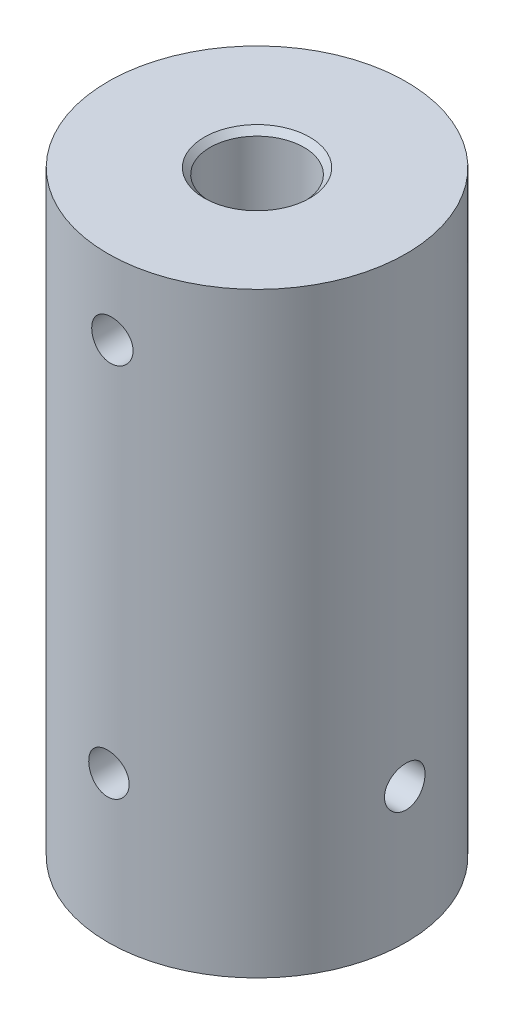
from build123d import *

# Parameters (mm, degrees)
SKETCH1_R                             = 12.7
BOSS_EXTRUDE1_DEPTH                   = 50.8
F_8_0_8_DIAMETER_HOLE1_D              = 8
F_8_0_8_DIAMETER_HOLE1_DEPTH          = 16.51
F_8_0_8_DIAMETER_HOLE1_CSINK_D        = 9
F_8_0_8_DIAMETER_HOLE1_CSINK_ANGLE    = 90
F_8_0_8_DIAMETER_HOLE1_TIP            = 2.403442476
F_8_32_TAPPED_HOLE1_REACH             = 54.894
F_8_32_TAPPED_HOLE1_BORE_R            = 1.7272
F_3_4_0_75_DIAMETER_HOLE1_D           = 19.05
F_3_4_0_75_DIAMETER_HOLE1_DEPTH       = 22.86
F_3_4_0_75_DIAMETER_HOLE1_CSINK_D     = 20.32
F_3_4_0_75_DIAMETER_HOLE1_CSINK_ANGLE = 90
F_3_4_0_75_DIAMETER_HOLE1_TIP         = 5.723197396
TAP_DRILL_FOR_8_32_TAP1_REACH         = 49.733
TAP_DRILL_FOR_8_32_TAP1_BORE_R        = 1.7272
TAP_DRILL_FOR_8_32_TAP2_REACH         = 50.487
TAP_DRILL_FOR_8_32_TAP2_BORE_R        = 1.7272


with BuildPart() as part:
    # Sketch1 → Boss-Extrude1 (new body)
    with BuildSketch(Plane(origin=(0, 0, 0), x_dir=(1, 0, 0), z_dir=(0, 1, 0))):
        with Locations(Location((0, 0, 0), (0, 0, 270))):
            Circle(SKETCH1_R)
    extrude(amount=BOSS_EXTRUDE1_DEPTH)

    # Ø8.0 (8) Diameter Hole1
    with Locations(Plane(origin=(0, 50.8, 0), x_dir=(1, 0, 0), z_dir=(0, 1, 0))):
        with Locations((0, 0)):
            CounterSinkHole(F_8_0_8_DIAMETER_HOLE1_D / 2, F_8_0_8_DIAMETER_HOLE1_CSINK_D / 2, depth=F_8_0_8_DIAMETER_HOLE1_DEPTH, counter_sink_angle=F_8_0_8_DIAMETER_HOLE1_CSINK_ANGLE)
            with Locations((0, 0, -(F_8_0_8_DIAMETER_HOLE1_DEPTH + F_8_0_8_DIAMETER_HOLE1_TIP / 2))):  # 118° drill point
                Cone(0, F_8_0_8_DIAMETER_HOLE1_D / 2, F_8_0_8_DIAMETER_HOLE1_TIP, mode=Mode.SUBTRACT)

    # #8-32 Tapped Hole1 bore (on position points) → #8-32 Tapped Hole1 (cut, up to next)
    with BuildSketch(Plane(origin=(0.258881907, 44.551690017, 12.697361149), x_dir=(0.999792216488, 0, -0.020384402145), z_dir=(0.020384402145, 0, 0.999792216488)), mode=Mode.PRIVATE) as f_8_32_tapped_hole1_sk1:
        Circle(F_8_32_TAPPED_HOLE1_BORE_R)
    f_8_32_tapped_hole1_tool1 = extrude(f_8_32_tapped_hole1_sk1.sketch, amount=-F_8_32_TAPPED_HOLE1_REACH, mode=Mode.PRIVATE) & part.part
    add(f_8_32_tapped_hole1_tool1.solids().sort_by_distance((0.258882, 44.55169, 12.697361))[0], mode=Mode.SUBTRACT)

    # 3/4 (0.75) Diameter Hole1
    with Locations(Plane(origin=(0, 0, 0), x_dir=(-1, 0, 0), z_dir=(0, -1, 0))):
        with Locations((0, 0)):
            CounterSinkHole(F_3_4_0_75_DIAMETER_HOLE1_D / 2, F_3_4_0_75_DIAMETER_HOLE1_CSINK_D / 2, depth=F_3_4_0_75_DIAMETER_HOLE1_DEPTH, counter_sink_angle=F_3_4_0_75_DIAMETER_HOLE1_CSINK_ANGLE)
            with Locations((0, 0, -(F_3_4_0_75_DIAMETER_HOLE1_DEPTH + F_3_4_0_75_DIAMETER_HOLE1_TIP / 2))):  # 118° drill point
                Cone(0, F_3_4_0_75_DIAMETER_HOLE1_D / 2, F_3_4_0_75_DIAMETER_HOLE1_TIP, mode=Mode.SUBTRACT)

    # Tap Drill for #8-32 Tap1 bore (on position points) → Tap Drill for #8-32 Tap1 (cut, up to next)
    with BuildSketch(Plane(origin=(-0.035098468, 12.444517797, 12.6999515), x_dir=(0.999996181087, 0, 0.002763658925), z_dir=(-0.002763658925, 0, 0.999996181087)), mode=Mode.PRIVATE) as tap_drill_for_8_32_tap1_sk1:
        Circle(TAP_DRILL_FOR_8_32_TAP1_BORE_R)
    tap_drill_for_8_32_tap1_tool1 = extrude(tap_drill_for_8_32_tap1_sk1.sketch, amount=-TAP_DRILL_FOR_8_32_TAP1_REACH, mode=Mode.PRIVATE) & part.part
    add(tap_drill_for_8_32_tap1_tool1.solids().sort_by_distance((-0.035098, 12.444518, 12.699951))[0], mode=Mode.SUBTRACT)

    # Tap Drill for #8-32 Tap2 bore (on position points) → Tap Drill for #8-32 Tap2 (cut, up to next)
    with BuildSketch(Plane(origin=(12.7, 11.499385571, 0), x_dir=(0, 0, 1), z_dir=(1, 0, 0)), mode=Mode.PRIVATE) as tap_drill_for_8_32_tap2_sk1:
        Circle(TAP_DRILL_FOR_8_32_TAP2_BORE_R)
    tap_drill_for_8_32_tap2_tool1 = extrude(tap_drill_for_8_32_tap2_sk1.sketch, amount=-TAP_DRILL_FOR_8_32_TAP2_REACH, mode=Mode.PRIVATE) & part.part
    add(tap_drill_for_8_32_tap2_tool1.solids().sort_by_distance((12.7, 11.499386, 0))[0], mode=Mode.SUBTRACT)


solid = part.part
